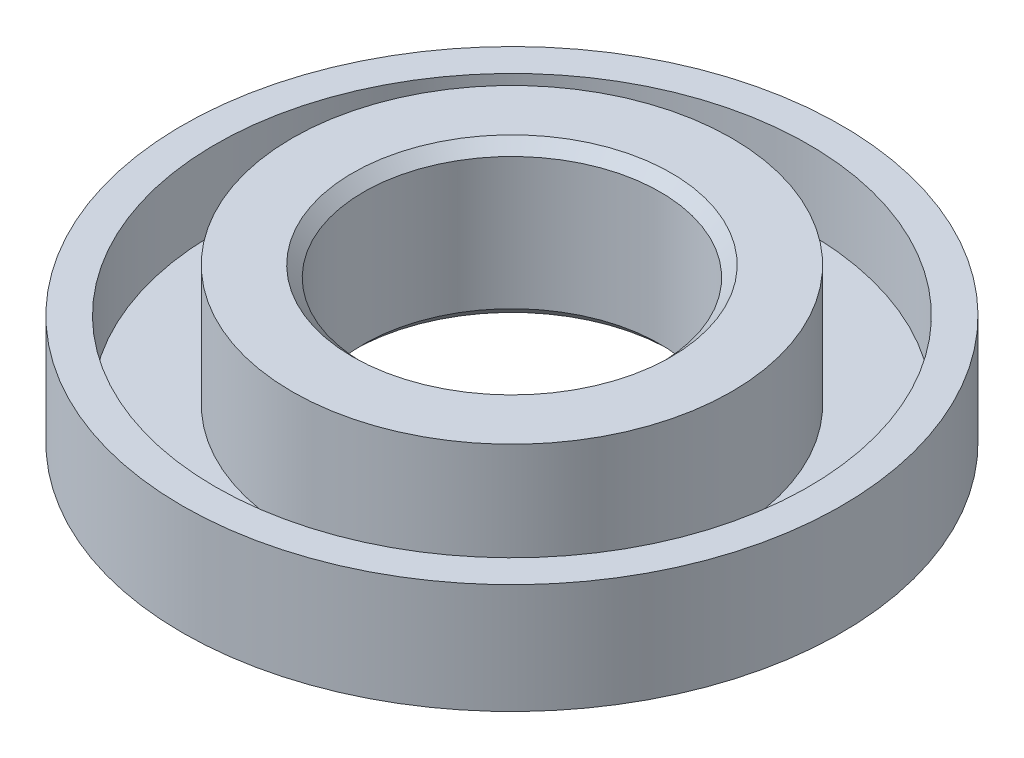
from build123d import *


with BuildPart() as part:
    # Эскиз1 → Повернуть1 (revolve)
    with BuildSketch(Plane(origin=(0, 0, 0), x_dir=(-1, 0, 0), z_dir=(0, 0, -1)), mode=Mode.PRIVATE) as revolve_1_sk:
        Polygon((-20, 14), (-20, 3), (-27, 3), (-27, 10), (-30, 10), (-30, 0), (-14.5, 0), (-13.5, 1), (-13.5, 13), (-14.5, 14), align=None)
    revolve(revolve_1_sk.sketch.rotate(Axis((0, 0, 0), (0, 1, 0)), 270), axis=Axis((0, 0, 0), (0, 1, 0)))


solid = part.part
